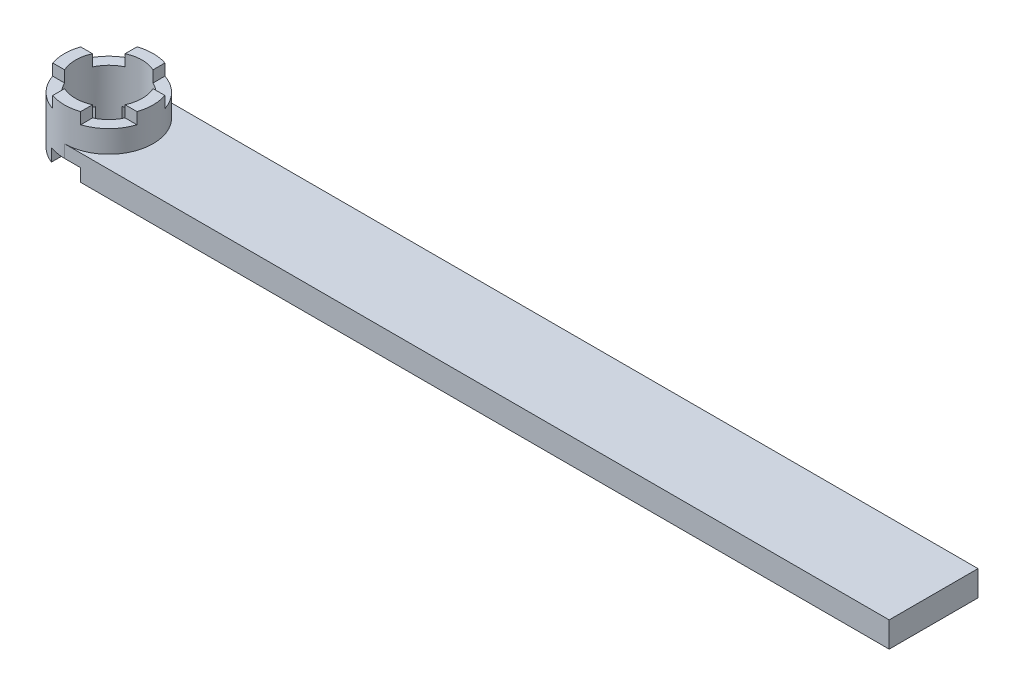
from build123d import *
from build123d.topology import SkipClean

# Parameters (mm, degrees)
SKETCH_1_R          = 7
SKETCH_1_R_2        = 5.25
EXTRUDE_3_DEPTH     = 4
SKETCH_2_R          = 7
SKETCH_2_R_2        = 5.25
EXTRUDE_4_DEPTH     = 3.5
CUT_EXTRUDE_1_DEPTH = 2
EXTRUDE_5_DEPTH     = 1.8


with BuildPart() as part:
    # 草图1 → 凸台-拉伸3 (new body)
    # profile 1 of 2: a face of its own
    with BuildSketch(Plane(origin=(0, 0, 0), x_dir=(1, 0, 0), z_dir=(0, 1, 0))):
        with BuildLine():
            Line((130, 7), (0, 7))
            ThreePointArc((0, 7), (4.949747468, 4.949747468), (7, 0))
            ThreePointArc((7, 0), (4.949747468, -4.949747468), (0, -7))
            Line((0, -7), (130, -7))
            Line((130, -7), (130, 7))
        make_face()
    # profile 2 of 2: a face of its own
    with BuildSketch(Plane(origin=(0, 0, 0), x_dir=(1, 0, 0), z_dir=(0, 1, 0))):
        Circle(SKETCH_1_R)
        with Locations(Location((0, 0, 0), (0, 0, 270))):
            Circle(SKETCH_1_R_2, mode=Mode.SUBTRACT)
    extrude(amount=EXTRUDE_3_DEPTH)

    # 草图2 → 凸台-拉伸4 (add)
    with BuildSketch(Plane(origin=(0, 4, 0), x_dir=(1, 0, 0), z_dir=(0, 1, 0))):
        with Locations(Location((0, 0, 0), (0, 0, 270))):
            Circle(SKETCH_2_R)
        with Locations(Location((0, 0, 0), (0, 0, 270))):
            Circle(SKETCH_2_R_2, mode=Mode.SUBTRACT)
    extrude(amount=EXTRUDE_4_DEPTH)

    # 草图3 → 切除-拉伸1 (cut)
    with BuildSketch(Plane.XZ):
        Polygon((-2.5, -8.5), (2.5, -8.5), (2.5, -2.5), (8, -2.5), (8, 2.5), (2.5, 2.5), (2.5, 8.5), (-2.5, 8.5), (-2.5, 2.5), (-8, 2.5), (-8, -2.5), (-2.5, -2.5), align=None)
    extrude(amount=-CUT_EXTRUDE_1_DEPTH, mode=Mode.SUBTRACT)

    # 草图4 → 凸台-拉伸5 (add)
    with SkipClean():  # the faces are left unmerged after this step: merging them gives an invalid solid
        with BuildSketch(Plane(origin=(0, 7.5, 0), x_dir=(1, 0, 0), z_dir=(0, 1, 0))):
            with BuildLine():
                ThreePointArc((-4.766812352, -2.2), (-5.25, 0), (-4.766812352, 2.2))
                Line((-4.766812352, 2.2), (-6.64529909, 2.2))
                ThreePointArc((-6.64529909, 2.2), (-7, 0), (-6.64529909, -2.2))
                Line((-6.64529909, -2.2), (-4.766812352, -2.2))
            make_face()
            with BuildLine():
                ThreePointArc((-2.2, 4.766812352), (0, 5.25), (2.2, 4.766812352))
                Line((2.2, 4.766812352), (2.2, 6.64529909))
                ThreePointArc((2.2, 6.64529909), (0, 7), (-2.2, 6.64529909))
                Line((-2.2, 6.64529909), (-2.2, 4.766812352))
            make_face()
            with BuildLine():
                Line((6.64529909, 2.2), (4.766812352, 2.2))
                ThreePointArc((4.766812352, 2.2), (5.127780458, 1.126218263), (5.25, 0))
                ThreePointArc((5.25, 0), (5.127780458, -1.126218263), (4.766812352, -2.2))
                Line((4.766812352, -2.2), (6.64529909, -2.2))
                ThreePointArc((6.64529909, -2.2), (6.910755879, -1.11420518), (7, 0))
                ThreePointArc((7, 0), (6.910755879, 1.11420518), (6.64529909, 2.2))
            make_face()
            with BuildLine():
                Line((2.2, -6.64529909), (2.2, -4.766812352))
                ThreePointArc((2.2, -4.766812352), (0, -5.25), (-2.2, -4.766812352))
                Line((-2.2, -4.766812352), (-2.2, -6.64529909))
                ThreePointArc((-2.2, -6.64529909), (0, -7), (2.2, -6.64529909))
            make_face()
        extrude(amount=EXTRUDE_5_DEPTH)


solid = part.part
